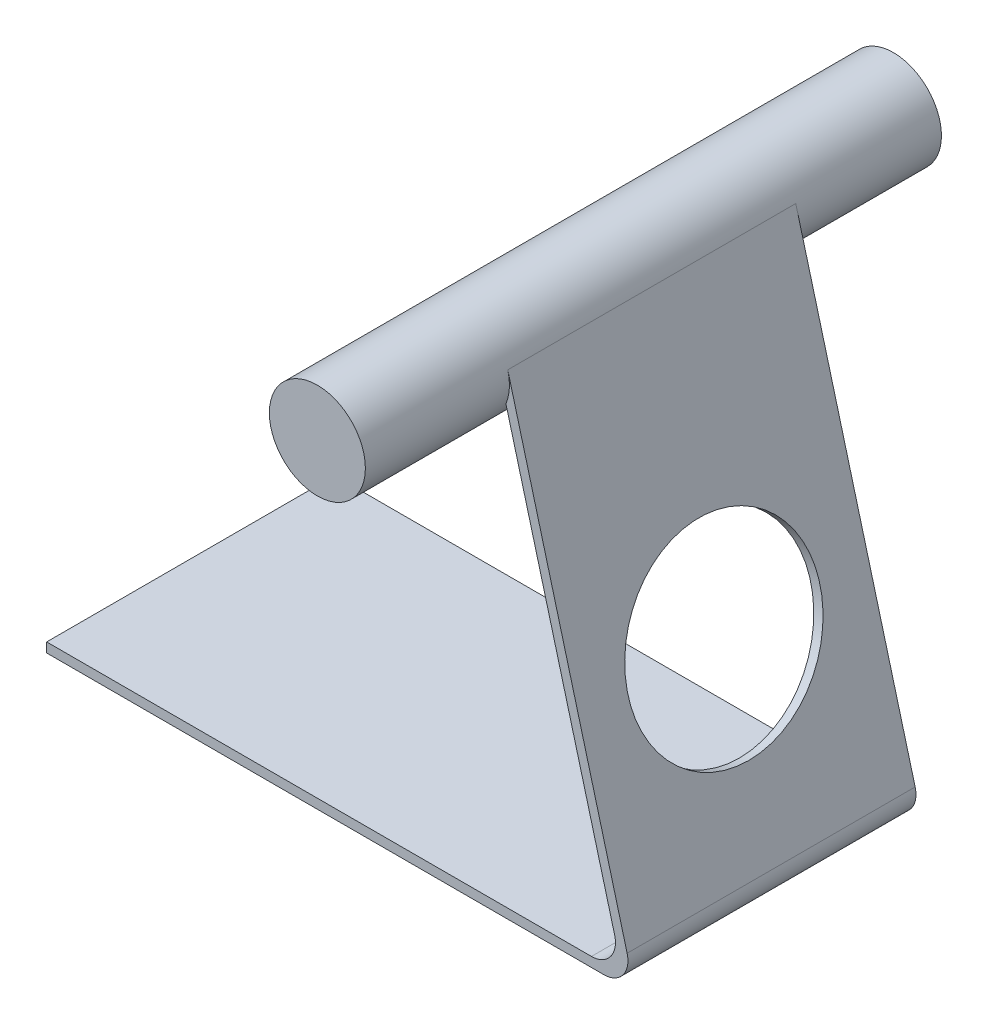
from build123d import *

# Parameters (mm, degrees)
BOSS_EXTRUDE1_DEPTH            = 76.2
FILLET1_R                      = 6.35
FILLET2_R                      = 6.35
CUT_EXTRUDE1_REACH             = 219.331
SKETCH2_R                      = 25.4
CUT_EXTRUDE1_DIRECTION_2_DEPTH = 218.330696
BOSS_EXTRUDE4_START            = 38.1
SKETCH5_R                      = 12.7
BOSS_EXTRUDE4_DEPTH            = 38.1
SKETCH6_R                      = 12.7
BOSS_EXTRUDE5_DEPTH            = 38.1


with BuildPart() as part:
    # Sketch1 → Boss-Extrude1 (new body)
    with BuildSketch(Plane.XY):
        with BuildLine():
            Line((-152.4, -2.54), (3.310192, -2.54))
            Line((3.310192, -2.54), (-30.416567, 123.32998))
            ThreePointArc((-30.416567, 123.32998), (-55.361009, 120.803902), (-30.897818, 115.312225))
            Line((-30.897818, 115.312225), (0, 0))
            Line((0, 0), (-152.4, 0))
            Line((-152.4, 0), (-152.4, -2.54))
        make_face()
    extrude(amount=BOSS_EXTRUDE1_DEPTH)

    # Fillet1
    fillet1_edges = [part.edges().sort_by_distance(p)[0] for p in [
        (0, 0, 38.1),
    ]]
    fillet(fillet1_edges, radius=FILLET1_R)

    # Fillet2
    fillet2_edges = [part.edges().sort_by_distance(p)[0] for p in [
        (3.310192, -2.54, 38.1),
    ]]
    fillet(fillet2_edges, radius=FILLET2_R)

    # Sketch2 → Cut-Extrude1 (cut, up to next)
    with BuildSketch(Plane(origin=(2.453452, 0.6574, 0), x_dir=(0, 0, -1), z_dir=(0.9659258262890685, 0.2588190451025197, 0)), mode=Mode.PRIVATE) as cut_extrude1_sk1:
        with Locations(Location((-38.1, 53.282644, 0), (0, 0, 270))):
            Circle(SKETCH2_R)
    cut_extrude1_tool1 = extrude(cut_extrude1_sk1.sketch, amount=-CUT_EXTRUDE1_REACH, mode=Mode.PRIVATE) & part.part
    add(cut_extrude1_tool1.solids().sort_by_distance((-11.337112, 52.124483, 38.1))[0], mode=Mode.SUBTRACT)

    # Sketch2 → Cut-Extrude1 direction 2 (cut)
    with BuildSketch(Plane(origin=(2.453452, 0.6574, 0), x_dir=(0, 0, -1), z_dir=(0.9659258262890685, 0.2588190451025197, 0))):
        with Locations(Location((-38.1, 53.282644, 0), (0, 0, 270))):
            Circle(SKETCH2_R)
    extrude(amount=CUT_EXTRUDE1_DIRECTION_2_DEPTH, mode=Mode.SUBTRACT)

    # Sketch5 → Boss-Extrude4 (add)
    with BuildSketch(Plane(origin=(0, 0, 0), x_dir=(-1, 0, 0), z_dir=(0, 0, -1)).offset(BOSS_EXTRUDE4_START)):
        with Locations((42.683825, 120.042978)):
            Circle(SKETCH5_R)
    extrude(amount=-BOSS_EXTRUDE4_DEPTH)

    # Sketch6 → Boss-Extrude5 (add)
    with BuildSketch(Plane.XY.offset(76.2)):
        with Locations(Location((-42.683825, 120.042978, 0), (0, 0, 180))):
            Circle(SKETCH6_R)
    extrude(amount=BOSS_EXTRUDE5_DEPTH)


solid = part.part
